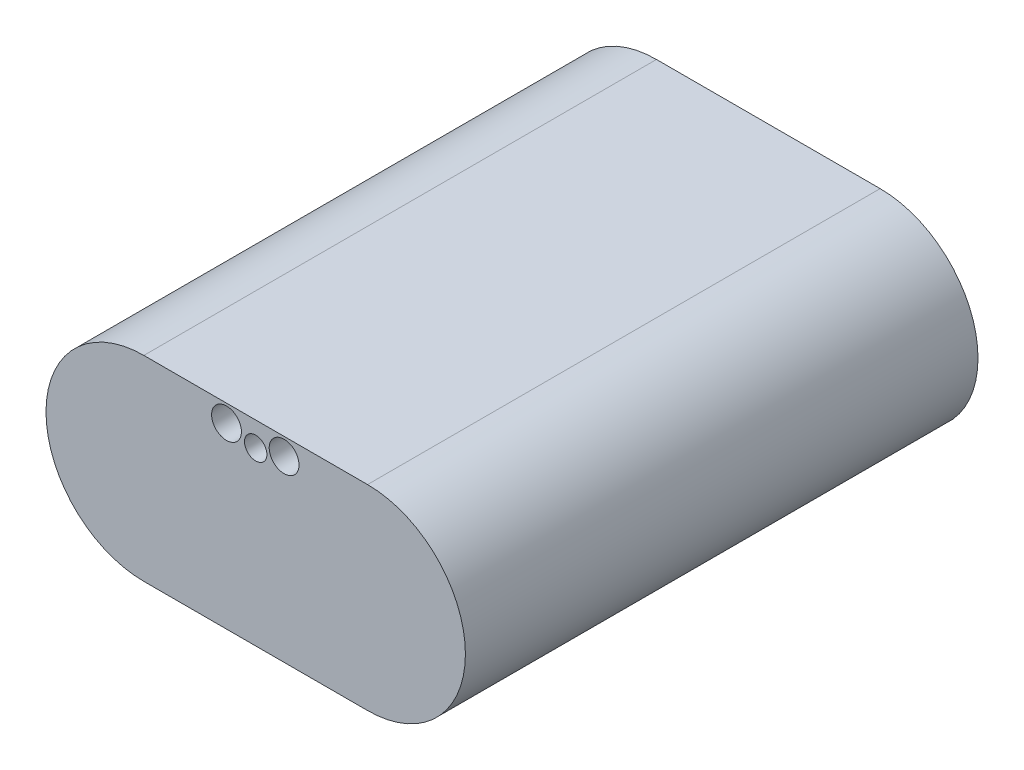
from build123d import *

# Parameters (mm, degrees)
SKETCH1_R           = 8
SKETCH1_R_2         = 6
BOSS_EXTRUDE1_DEPTH = 137.5


with BuildPart() as part:
    # Sketch1 → Boss-Extrude1 (new, symmetric)
    with BuildSketch(Plane.XY):
        with BuildLine():
            Line((60, 52.5), (-60, 52.5))
            ThreePointArc((-60, 52.5), (-112.5, 0), (-60, -52.5))
            Line((-60, -52.5), (60, -52.5))
            ThreePointArc((60, -52.5), (112.5, 0), (60, 52.5))
        make_face()
        with Locations((-15.656784535, 43.172154608)):
            Circle(SKETCH1_R, mode=Mode.SUBTRACT)
        with Locations((0, 39.445617679)):
            Circle(SKETCH1_R_2, mode=Mode.SUBTRACT)
        with Locations((15.24070295, 43.172154608)):
            Circle(SKETCH1_R, mode=Mode.SUBTRACT)
    extrude(amount=BOSS_EXTRUDE1_DEPTH, both=True)


solid = part.part
